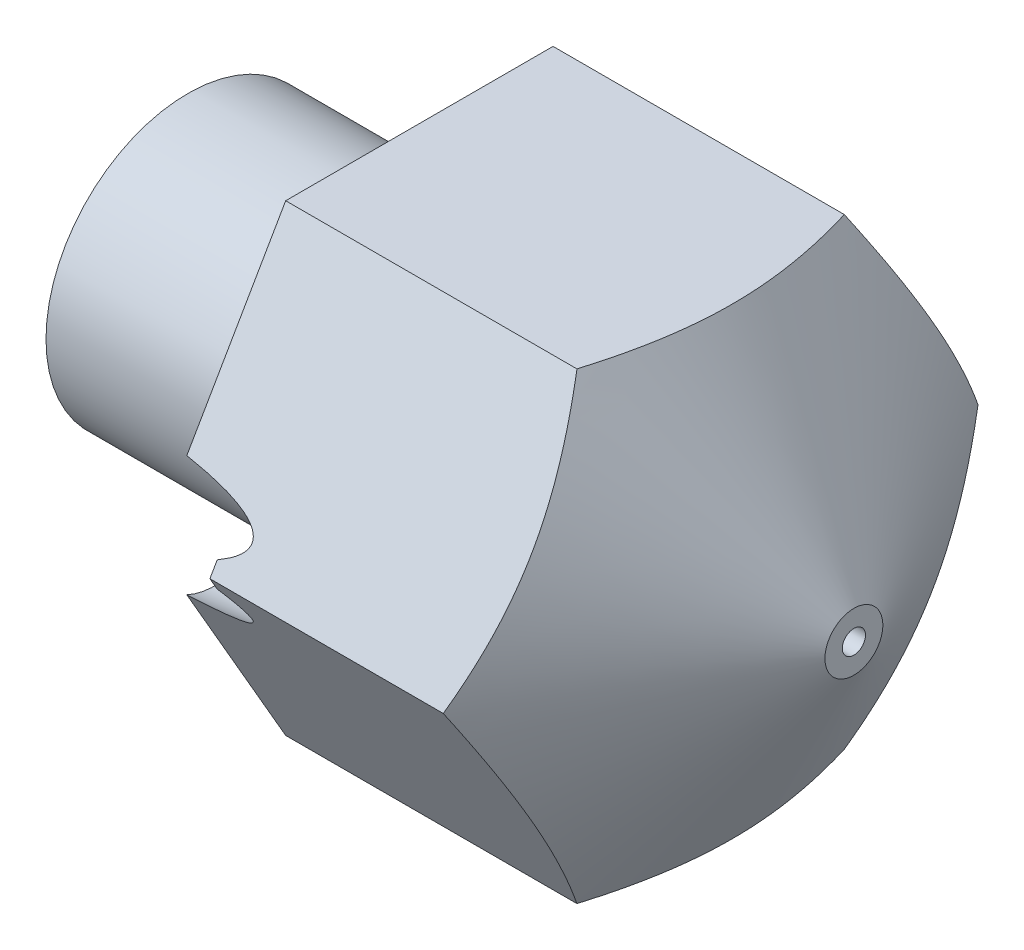
from build123d import *

# Parameters (mm, degrees)
SKETCH2_OUTSIDE_W  = 23.078
SKETCH2_OUTSIDE_H  = 23.078
CUT_EXTRUDE1_DEPTH = 17.136867678
SKETCH4_W          = 1
SKETCH4_H          = 1
CUT_EXTRUDE2_DEPTH = 1


with BuildPart() as part:
    # Sketch1 → Revolve1 (revolve)
    with BuildSketch(Plane.XY, mode=Mode.PRIVATE) as revolve1_sk:
        Polygon((-7.506454643, 8), (-4.506454643, 8), (0, 0.5), (0, 0.2), (-0.5, 0.2), (-0.980688495, 1), (-8.506454643, 1), (-8.897014045, 1.65), (-11.506454643, 1.65), (-11.506454643, 2.45), (-7.506454643, 2.45), align=None)
    revolve(revolve1_sk.sketch.rotate(Axis((-1000, 0, 0), (1, 0, 0)), 90), axis=Axis((-1000, 0, 0), (1, 0, 0)))

    # Sketch2 outside → Cut-Extrude1 (cut, through all)
    with BuildSketch(Plane(origin=(0, 0, 0), x_dir=(0, 0, -1), z_dir=(1, 0, 0))):
        Rectangle(SKETCH2_OUTSIDE_W, SKETCH2_OUTSIDE_H)
        Polygon((4.618802154, 0), (2.309401077, 4), (-2.309401077, 4), (-4.618802154, 0), (-2.309401077, -4), (2.309401077, -4), align=None, mode=Mode.SUBTRACT)
    extrude(amount=-CUT_EXTRUDE1_DEPTH, mode=Mode.SUBTRACT)

    # Sketch3 → Cut-Revolve1 (revolve, cut)
    with BuildSketch(Plane(origin=(0, 0, 0), x_dir=(1, 0, 0), z_dir=(0, 1, 0)), mode=Mode.PRIVATE) as cut_revolve1_sk:
        Polygon((-10.36359318, -4.026237068), (-10.163897775, -5.158765984), (-2.285435751, -3.769580562), (-1.80463913, -2.517062542), align=None)
    revolve(cut_revolve1_sk.sketch.rotate(Axis((-1.80463913, 0, 2.517062542), (-0.9848077530122068, 0, 0.17364817766693816)), 180), axis=Axis((-1.80463913, 0, 2.517062542), (-0.9848077530122068, 0, 0.17364817766693816)), mode=Mode.SUBTRACT)

    # Sketch4 → Cut-Extrude2 (cut)
    with BuildSketch(Plane.ZY.offset(7.506454643)):
        with Locations((4.118802154, 0)):
            Rectangle(SKETCH4_W, SKETCH4_H)
    extrude(amount=-CUT_EXTRUDE2_DEPTH, mode=Mode.SUBTRACT)


solid = part.part
